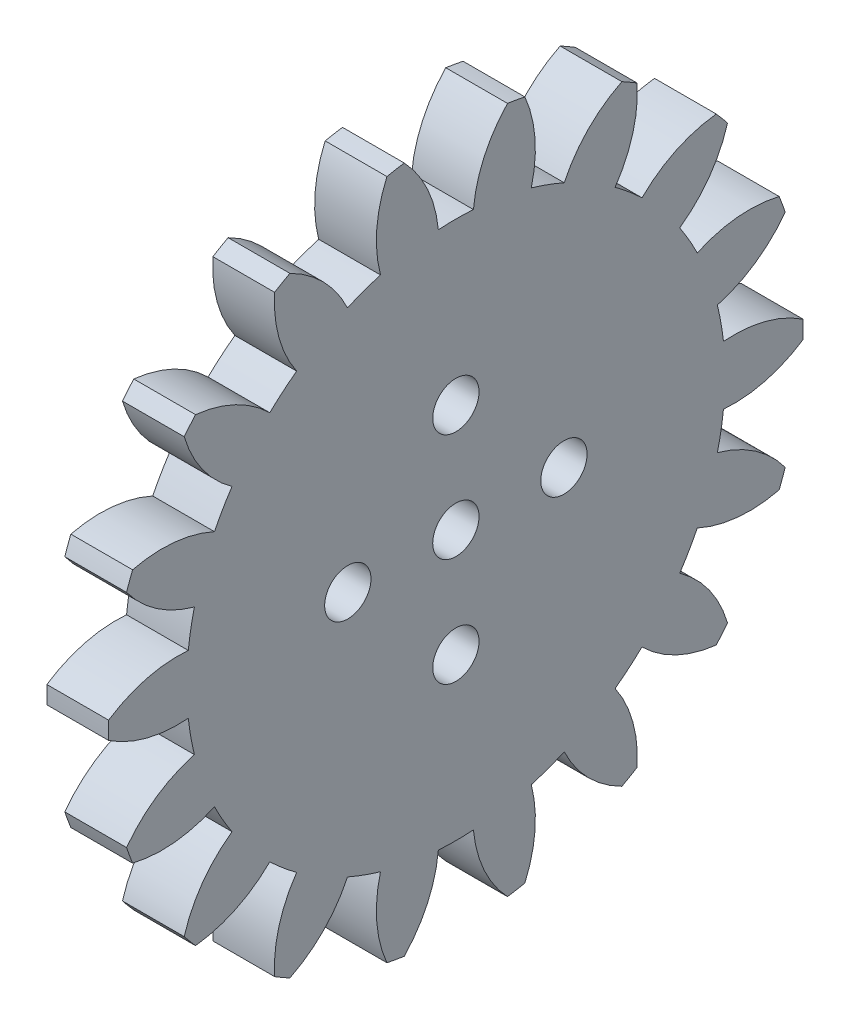
from build123d import *

# Parameters (mm, degrees)
BASPROSKE_W         = 4
BASPROSKE_H         = 22.5
TOOTHCUT_DEPTH      = 33.070235422
TEETHCUTS_COUNT     = 18
TEETHCUTS_ANGLE     = 340
BORSKE_R            = 1.5
BORE_DEPTH          = 50.0000508
SKETCH_1_R          = 1.5
CUT_EXTRUDE_1_DEPTH = 32.895398001


with BuildPart() as part:
    # BasProSke → Base-Revolve (revolve)
    with BuildSketch(Plane(origin=(0, 0, 0), x_dir=(1, 0, 0), z_dir=(0, 1, 0)), mode=Mode.PRIVATE) as base_revolve_sk:
        with Locations((2, 11.25)):
            Rectangle(BASPROSKE_W, BASPROSKE_H)
    revolve(base_revolve_sk.sketch.rotate(Axis((-10, 0, 0), (1, 0, 0)), 180), axis=Axis((-10, 0, 0), (1, 0, 0)))

    # TooCutSke → ToothCut (cut, through all)
    with BuildSketch(Plane(origin=(0, 0, 0), x_dir=(0, 0, -1), z_dir=(1, 0, 0))):
        with BuildLine():
            ThreePointArc((1.136237076, 17.399439576), (0, 17.4365), (-1.136237076, 17.399439576))
            ThreePointArc((-1.136237076, 17.399439576), (-1.836299497, 20.025700007), (-3.36570362, 22.272532059))
            ThreePointArc((-3.36570362, 22.272532059), (0, 22.5254), (3.36570362, 22.272532059))
            ThreePointArc((3.36570362, 22.272532059), (1.836299497, 20.025700007), (1.136237076, 17.399439576))
        make_face()
    toothcut = extrude(amount=TOOTHCUT_DEPTH, mode=Mode.SUBTRACT)

    # TeethCuts: ToothCut ×18 about axis
    teethcuts_axis = Axis((-10, 0, 0), (1, 0, 0))
    for i in range(1, TEETHCUTS_COUNT):
        add(toothcut.rotate(teethcuts_axis, i * TEETHCUTS_ANGLE / (TEETHCUTS_COUNT - 1)), mode=Mode.SUBTRACT)

    # BorSke → Bore (cut, symmetric)
    with BuildSketch(Plane(origin=(0, 0, 0), x_dir=(0, 0, -1), z_dir=(1, 0, 0))):
        with Locations(Location((0, 0, 0), (0, 0, 180))):
            Circle(BORSKE_R)
    extrude(amount=BORE_DEPTH, both=True, mode=Mode.SUBTRACT)

    # 草图1 → 切除-拉伸1 (cut, through all)
    with BuildSketch(Plane(origin=(4, 0, 0), x_dir=(0, 0, -1), z_dir=(1, 0, 0))):
        with Locations((0, 7)):
            Circle(SKETCH_1_R)
        with Locations((7, 0)):
            Circle(SKETCH_1_R)
        with Locations((-7, 0)):
            Circle(SKETCH_1_R)
        with Locations((0, -7)):
            Circle(SKETCH_1_R)
    extrude(amount=-CUT_EXTRUDE_1_DEPTH, mode=Mode.SUBTRACT)


solid = part.part
